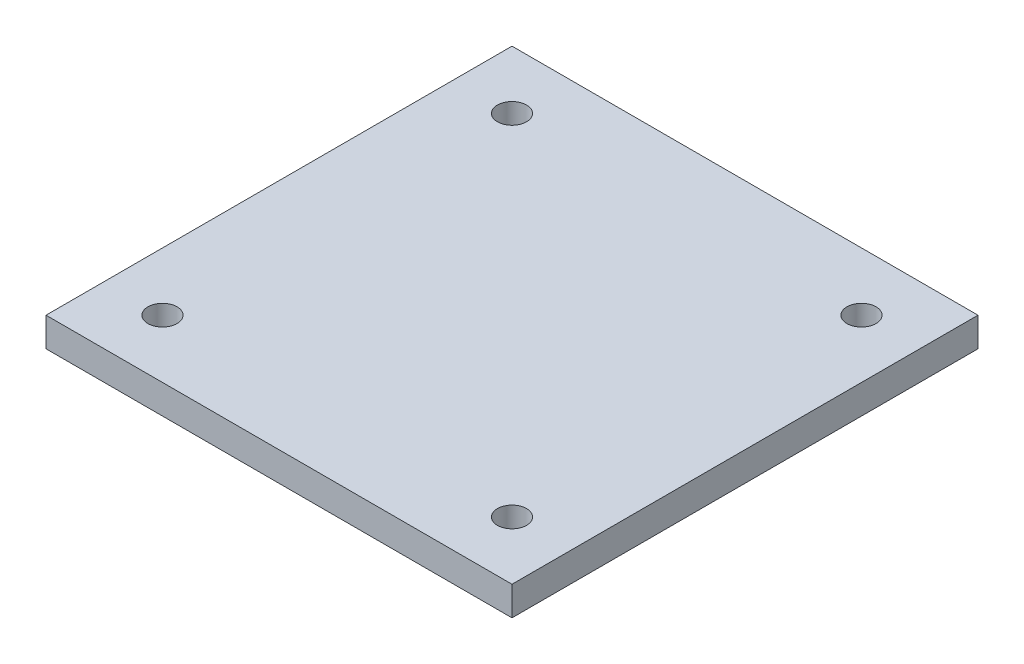
from build123d import *

# Parameters (mm, degrees)
SKETCH1_W           = 101.6
SKETCH1_H           = 101.6
SKETCH1_R           = 3.175
BOSS_EXTRUDE1_DEPTH = 6.35


with BuildPart() as part:
    # Sketch1 → Boss-Extrude1 (new body)
    with BuildSketch(Plane(origin=(0, 0, 0), x_dir=(1, 0, 0), z_dir=(0, 1, 0))):
        Rectangle(SKETCH1_W, SKETCH1_H)
        with Locations(Location((-38.1, 38.1, 0), (0, 0, 270))):
            Circle(SKETCH1_R, mode=Mode.SUBTRACT)
        with Locations(Location((38.1, 38.1, 0), (0, 0, 270))):
            Circle(SKETCH1_R, mode=Mode.SUBTRACT)
        with Locations(Location((38.1, -38.1, 0), (0, 0, 270))):
            Circle(SKETCH1_R, mode=Mode.SUBTRACT)
        with Locations(Location((-38.1, -38.1, 0), (0, 0, 270))):
            Circle(SKETCH1_R, mode=Mode.SUBTRACT)
    extrude(amount=BOSS_EXTRUDE1_DEPTH)


solid = part.part
